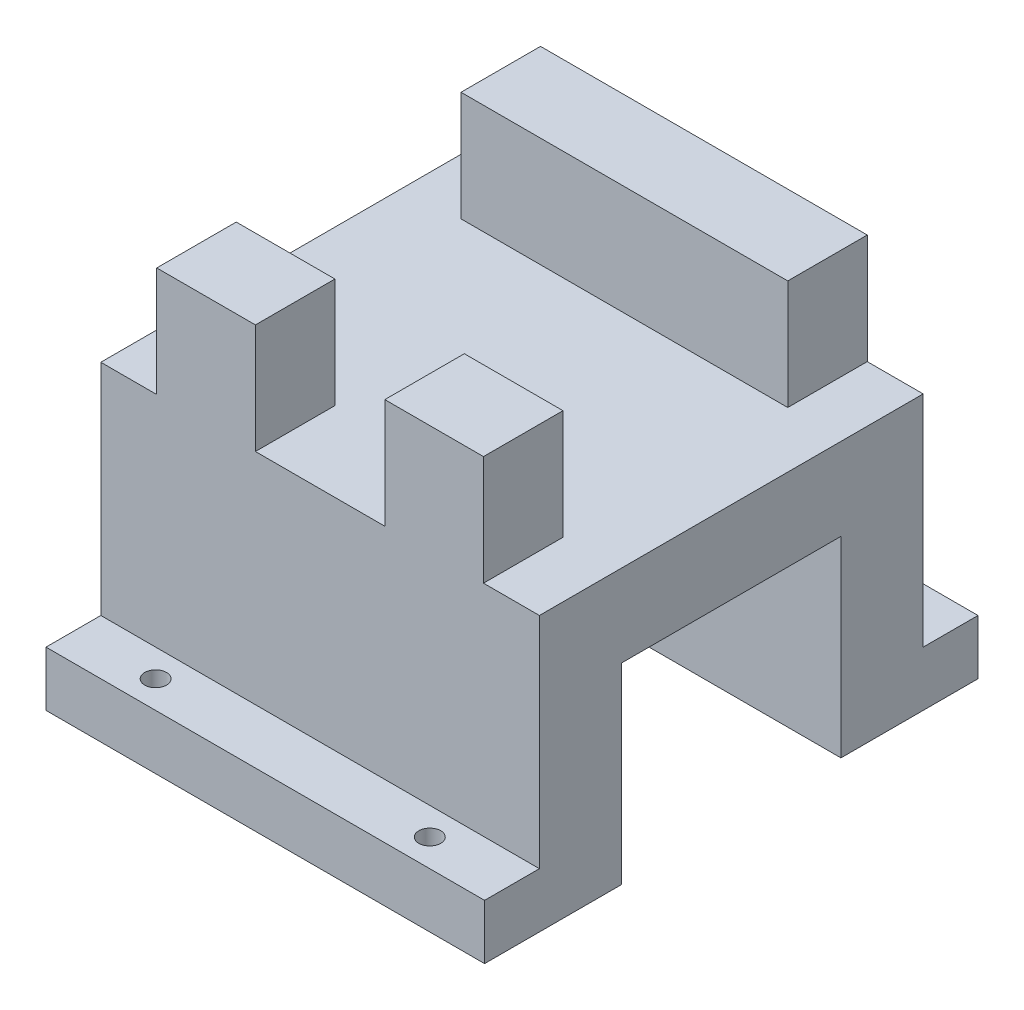
from build123d import *

# Parameters (mm, degrees)
SKETCH1_W           = 80
SKETCH1_H           = 90
BOSS_EXTRUDE1_DEPTH = 10
SKETCH2_W           = 80
SKETCH2_H           = 70
BOSS_EXTRUDE2_DEPTH = 40
SKETCH3_W           = 59.6
SKETCH3_H           = 14.5
BOSS_EXTRUDE3_DEPTH = 20
CUT_EXTRUDE1_REACH  = 115.578
SKETCH6_W           = 23.6
SKETCH6_H           = 20
CUT_EXTRUDE2_REACH  = 117.434
SKETCH7_W           = 40
SKETCH7_H           = 35
CUT_EXTRUDE3_REACH  = 87
SKETCH8_R           = 2


with BuildPart() as part:
    # Sketch1 → Boss-Extrude1 (new body)
    with BuildSketch(Plane(origin=(0, 0, 0), x_dir=(1, 0, 0), z_dir=(0, 1, 0))):
        Rectangle(SKETCH1_W, SKETCH1_H)
    extrude(amount=BOSS_EXTRUDE1_DEPTH)

    # Sketch2 → Boss-Extrude2 (add)
    with BuildSketch(Plane(origin=(0, 10, 0), x_dir=(1, 0, 0), z_dir=(0, 1, 0))):
        Rectangle(SKETCH2_W, SKETCH2_H)
    extrude(amount=BOSS_EXTRUDE2_DEPTH)

    # Sketch3 → Boss-Extrude3 (add)
    with BuildSketch(Plane(origin=(0, 50, 0), x_dir=(1, 0, 0), z_dir=(0, 1, 0))):
        with Locations((0, -27.75)):
            Rectangle(SKETCH3_W, SKETCH3_H)
        with Locations((0, 27.75)):
            Rectangle(SKETCH3_W, SKETCH3_H)
    extrude(amount=BOSS_EXTRUDE3_DEPTH)

    # Sketch6 → Cut-Extrude1 (cut, up to next)
    with BuildSketch(Plane.XY.offset(35), mode=Mode.PRIVATE) as cut_extrude1_sk1:
        with Locations((0, 60)):
            Rectangle(SKETCH6_W, SKETCH6_H)
    cut_extrude1_tool1 = extrude(cut_extrude1_sk1.sketch, amount=-CUT_EXTRUDE1_REACH, mode=Mode.PRIVATE) & part.part
    add(cut_extrude1_tool1.solids().sort_by_distance((0, 60, 35))[0], mode=Mode.SUBTRACT)

    # Sketch7 → Cut-Extrude2 (cut, up to next)
    with BuildSketch(Plane.ZY.offset(40), mode=Mode.PRIVATE) as cut_extrude2_sk1:
        with Locations((0, 17.5)):
            Rectangle(SKETCH7_W, SKETCH7_H)
    cut_extrude2_tool1 = extrude(cut_extrude2_sk1.sketch, amount=-CUT_EXTRUDE2_REACH, mode=Mode.PRIVATE) & part.part
    add(cut_extrude2_tool1.solids().sort_by_distance((-40, 17.5, 0))[0], mode=Mode.SUBTRACT)

    # Sketch8 → Cut-Extrude3 (cut, up to next)
    with BuildSketch(Plane(origin=(0, 10, 0), x_dir=(1, 0, 0), z_dir=(0, 1, 0)), mode=Mode.PRIVATE) as cut_extrude3_sk1:
        with Locations(Location((-25, -40, 0), (0, 0, 270))):
            Circle(SKETCH8_R)
    cut_extrude3_tool1 = extrude(cut_extrude3_sk1.sketch, amount=-CUT_EXTRUDE3_REACH, mode=Mode.PRIVATE) & part.part
    # Sketch8 → Cut-Extrude3 (cut, up to next)
    with BuildSketch(Plane(origin=(0, 10, 0), x_dir=(1, 0, 0), z_dir=(0, 1, 0)), mode=Mode.PRIVATE) as cut_extrude3_sk2:
        with Locations(Location((25, -40, 0), (0, 0, 270))):
            Circle(SKETCH8_R)
    cut_extrude3_tool2 = extrude(cut_extrude3_sk2.sketch, amount=-CUT_EXTRUDE3_REACH, mode=Mode.PRIVATE) & part.part
    # Sketch8 → Cut-Extrude3 (cut, up to next)
    with BuildSketch(Plane(origin=(0, 10, 0), x_dir=(1, 0, 0), z_dir=(0, 1, 0)), mode=Mode.PRIVATE) as cut_extrude3_sk3:
        with Locations(Location((25, 40, 0), (0, 0, 270))):
            Circle(SKETCH8_R)
    cut_extrude3_tool3 = extrude(cut_extrude3_sk3.sketch, amount=-CUT_EXTRUDE3_REACH, mode=Mode.PRIVATE) & part.part
    # Sketch8 → Cut-Extrude3 (cut, up to next)
    with BuildSketch(Plane(origin=(0, 10, 0), x_dir=(1, 0, 0), z_dir=(0, 1, 0)), mode=Mode.PRIVATE) as cut_extrude3_sk4:
        with Locations(Location((-25, 40, 0), (0, 0, 270))):
            Circle(SKETCH8_R)
    cut_extrude3_tool4 = extrude(cut_extrude3_sk4.sketch, amount=-CUT_EXTRUDE3_REACH, mode=Mode.PRIVATE) & part.part
    add(cut_extrude3_tool1.solids().sort_by_distance((-25, 10, 40))[0], mode=Mode.SUBTRACT)
    add(cut_extrude3_tool2.solids().sort_by_distance((25, 10, 40))[0], mode=Mode.SUBTRACT)
    add(cut_extrude3_tool3.solids().sort_by_distance((25, 10, -40))[0], mode=Mode.SUBTRACT)
    add(cut_extrude3_tool4.solids().sort_by_distance((-25, 10, -40))[0], mode=Mode.SUBTRACT)


solid = part.part
